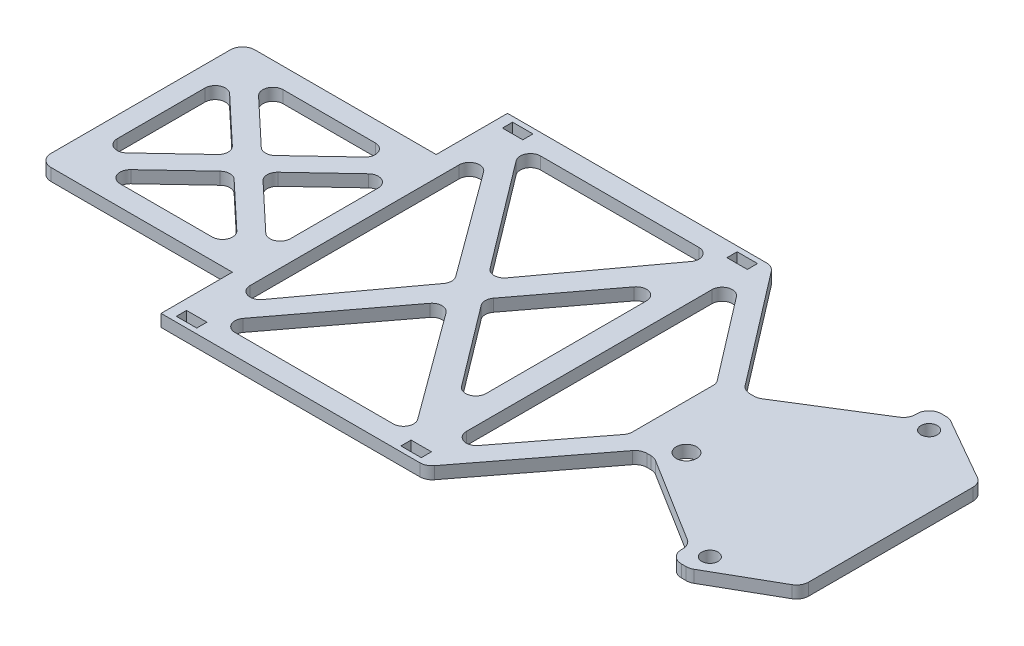
from build123d import *

# Parameters (mm, degrees)
SKETCH1_R           = 4
BOSS_EXTRUDE1_DEPTH = 6
FILLET1_R           = 6
CUT_EXTRUDE1_DEPTH  = 6
FILLET3_R           = 5
SKETCH3_R           = 5.01
CUT_EXTRUDE2_DEPTH  = 10
SKETCH4_W           = 10
SKETCH4_H           = 5
CUT_EXTRUDE3_DEPTH  = 10


with BuildPart() as part:
    # Sketch1 → Boss-Extrude1 (new body)
    with BuildSketch(Plane(origin=(0, 0, 0), x_dir=(1, 0, 0), z_dir=(0, 1, 0))):
        Polygon((277.331893801, -59.723964411), (274.249458289, -59.723964411), (270.793440906, -59.723964411), (225, 0), (95, 0), (95, -35), (0, -35), (0, -135), (95, -135), (95, -170), (225, -170), (270.793440906, -110.276035589), (274.249458289, -110.276035589), (277.331893801, -110.276035589), (323.076052888, -138.788463278), (323.076052888, -148.788463278), (333.076052888, -148.788463278), (368.076052888, -128.788463278), (368.076052888, -41.211536722), (333.076052888, -21.211536722), (323.076052888, -21.211536722), (323.076052888, -31.211536722), align=None)
        with Locations(Location((333.076052888, -138.788463278, 0), (0, 0, 270))):
            Circle(SKETCH1_R, mode=Mode.SUBTRACT)
        with Locations(Location((333.076052888, -31.211536722, 0), (0, 0, 90))):
            Circle(SKETCH1_R, mode=Mode.SUBTRACT)
    extrude(amount=BOSS_EXTRUDE1_DEPTH)

    # Fillet1
    fillet1_edges = [part.edges().sort_by_distance(p)[0] for p in [
        (323.076052888, 3, 31.211536722),
        (323.076052888, 3, 21.211536722),
        (333.076052888, 3, 21.211536722),
        (368.076052888, 3, 41.211536722),
        (368.076052888, 3, 128.788463278),
        (333.076052888, 3, 148.788463278),
        (323.076052888, 3, 148.788463278),
        (323.076052888, 3, 138.788463278),
        (277.331893801, 3, 110.276035589),
        (270.793440906, 3, 110.276035589),
        (225, 3, 170),
        (0, 3, 135),
        (0, 3, 35),
        (225, 3, 0),
        (270.793440906, 3, 59.723964411),
        (277.331893801, 3, 59.723964411),
    ]]
    fillet(fillet1_edges, radius=FILLET1_R)

    # Sketch2 → Cut-Extrude1 (cut)
    with BuildSketch(Plane(origin=(0, 6, 0), x_dir=(1, 0, 0), z_dir=(0, 1, 0))):
        Polygon((261.056483321, -63.459547708), (220.066293487, -10), (220.066293487, -160), (261.056483321, -106.540452292), align=None)
        Polygon((160.709522788, -75.577434726), (208.799641587, -10), (111.200358413, -10), align=None)
        Polygon((111.200358413, -160), (208.799641587, -160), (160.709522788, -94.422565274), align=None)
        Polygon((153.799641587, -85), (105, -18.455034199), (105, -151.544965801), align=None)
        Polygon((52.5, -78.133754394), (87.704614044, -45), (17.295385956, -45), align=None)
        Polygon((17.295385956, -125), (87.704614044, -125), (52.5, -91.866245606), align=None)
        Polygon((45.204614044, -85), (10, -51.866245606), (10, -118.133754394), align=None)
        Polygon((95, -51.866245606), (59.795385956, -85), (95, -118.133754394), align=None)
        Polygon((208.799641587, -139.275270598), (208.799641587, -30.724729402), (167.823301101, -85), align=None)
    extrude(amount=-CUT_EXTRUDE1_DEPTH, mode=Mode.SUBTRACT)

    # Fillet3
    fillet3_edges = [part.edges().sort_by_distance(p)[0] for p in [
        (59.795385956, 3, 85),
        (95, 3, 51.866245606),
        (95, 3, 118.133754394),
        (52.5, 3, 78.133754394),
        (17.295385956, 3, 45),
        (87.704614044, 3, 45),
        (105, 3, 18.455034199),
        (153.799641587, 3, 85),
        (105, 3, 151.544965801),
        (111.200358413, 3, 160),
        (160.709522788, 3, 94.422565274),
        (208.799641587, 3, 160),
        (261.056483321, 3, 63.459547708),
        (261.056483321, 3, 106.540452292),
        (220.066293487, 3, 160),
        (220.066293487, 3, 10),
        (208.799641587, 3, 10),
        (160.709522788, 3, 75.577434726),
        (111.200358413, 3, 10),
        (17.295385956, 3, 125),
        (52.5, 3, 91.866245606),
        (87.704614044, 3, 125),
        (10, 3, 51.866245606),
        (45.204614044, 3, 85),
        (10, 3, 118.133754394),
        (167.823301101, 3, 85),
        (208.799641587, 3, 30.724729402),
        (208.799641587, 3, 139.275270598),
    ]]
    fillet(fillet3_edges, radius=FILLET3_R)

    # Sketch3 → Cut-Extrude2 (cut)
    with BuildSketch(Plane(origin=(0, 6, 0), x_dir=(1, 0, 0), z_dir=(0, 1, 0))):
        with Locations(Location((283.076052888, -100.276035589, 0), (0, 0, 270))):
            Circle(SKETCH3_R)
    extrude(amount=-CUT_EXTRUDE2_DEPTH, mode=Mode.SUBTRACT)

    # Sketch4 → Cut-Extrude3 (cut)
    with BuildSketch(Plane(origin=(0, 6, 0), x_dir=(1, 0, 0), z_dir=(0, 1, 0))):
        with Locations((105, -5)):
            Rectangle(SKETCH4_W, SKETCH4_H)
        with Locations((215.172787049, -5)):
            Rectangle(SKETCH4_W, SKETCH4_H)
        with Locations((215.172787049, -165)):
            Rectangle(SKETCH4_W, SKETCH4_H)
        with Locations((105, -165)):
            Rectangle(SKETCH4_W, SKETCH4_H)
    extrude(amount=-CUT_EXTRUDE3_DEPTH, mode=Mode.SUBTRACT)


solid = part.part
